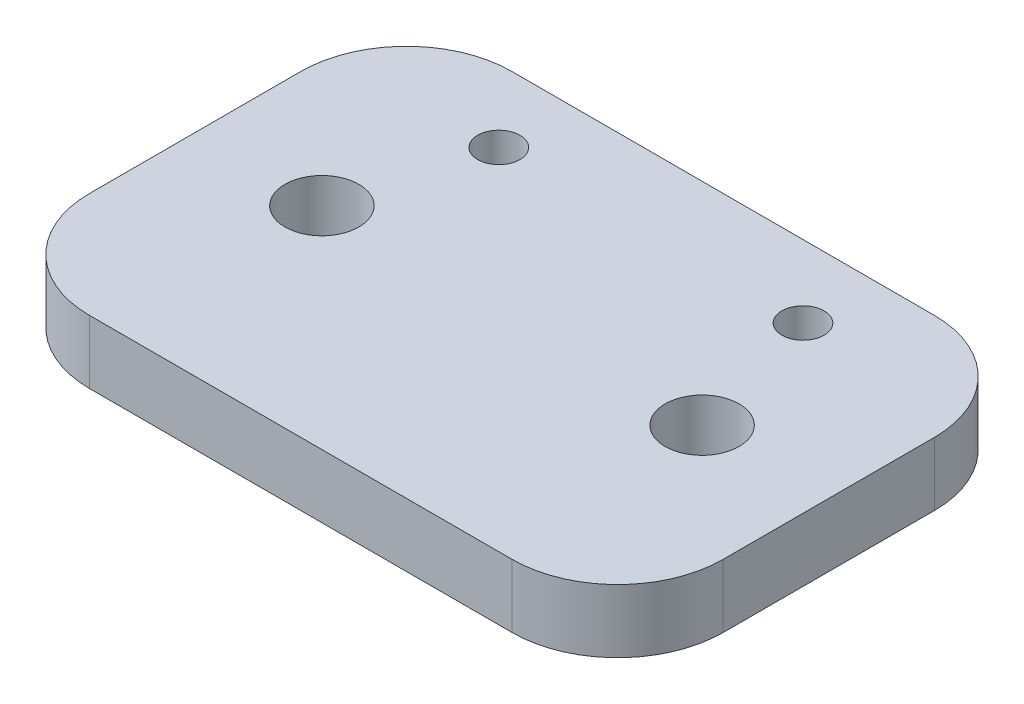
from build123d import *

# Parameters (mm, degrees)
SKETCH_1_R      = 1.75
SKETCH_1_R_2    = 1
EXTRUDE_1_DEPTH = 3


with BuildPart() as part:
    # 草图1 → 凸台-拉伸1 (new body)
    with BuildSketch(Plane(origin=(0, 0, 0), x_dir=(1, 0, 0), z_dir=(0, 1, 0))):
        with BuildLine():
            Line((-10, -10), (10, -10))
            ThreePointArc((10, -10), (13.535533906, -8.535533906), (15, -5))
            Line((15, -5), (15, 5))
            ThreePointArc((15, 5), (13.535533906, 8.535533906), (10, 10))
            Line((10, 10), (-10, 10))
            ThreePointArc((-10, 10), (-13.535533906, 8.535533906), (-15, 5))
            Line((-15, 5), (-15, -5))
            ThreePointArc((-15, -5), (-13.535533906, -8.535533906), (-10, -10))
        make_face()
        with Locations(Location((-9, 0, 0), (0, 0, 270))):
            Circle(SKETCH_1_R, mode=Mode.SUBTRACT)
        with Locations(Location((9, 0, 0), (0, 0, 270))):
            Circle(SKETCH_1_R, mode=Mode.SUBTRACT)
        with Locations(Location((7.2, 6.575, 0), (0, 0, 270))):
            Circle(SKETCH_1_R_2, mode=Mode.SUBTRACT)
        with Locations(Location((-7.2, 6.575, 0), (0, 0, 270))):
            Circle(SKETCH_1_R_2, mode=Mode.SUBTRACT)
    extrude(amount=EXTRUDE_1_DEPTH)


solid = part.part
